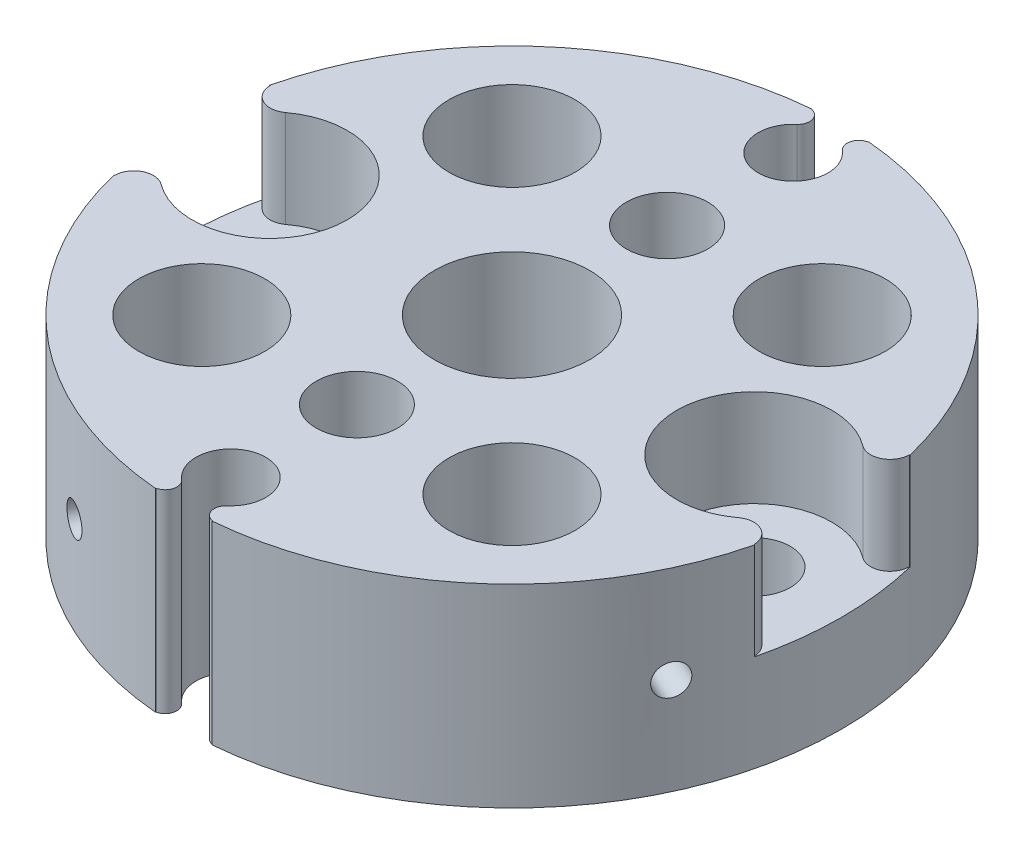
from build123d import *

# Parameters (mm, degrees)
SKETCH1_R                  = 17
BOSS_EXTRUDE1_DEPTH        = 10
F_3_7_3_7_DIAMETER_HOLE1_D = 3.7
M5_TAPPED_HOLE1_D          = 4.2
F_12_0_12_DIAMETER_HOLE1_D = 8
CUT_EXTRUDE3_DEPTH         = 5
CIRPATTERN1_COUNT          = 4
SKETCH21_R                 = 3.25
CUT_EXTRUDE4_DEPTH         = 27.038433302
CUT_EXTRUDE5_DEPTH         = 27.038433302


with BuildPart() as part:
    # Sketch1 → Boss-Extrude1 (new body)
    with BuildSketch(Plane(origin=(0, 0, 0), x_dir=(1, 0, 0), z_dir=(0, 1, 0))):
        with Locations(Location((0, 0, 0), (0, 0, 270))):
            Circle(SKETCH1_R)
    extrude(amount=BOSS_EXTRUDE1_DEPTH)

    # Ø3.7 (3.7) Diameter Hole1 (through all)
    with Locations(Plane(origin=(0, 10, 0), x_dir=(1, 0, 0), z_dir=(0, 1, 0))):
        with Locations((-12.5, 0), (12.5, 0)):
            Hole(F_3_7_3_7_DIAMETER_HOLE1_D / 2)

    # M5 Tapped Hole1 (through all)
    with Locations(Plane(origin=(0, 10, 0), x_dir=(1, 0, 0), z_dir=(0, 1, 0))):
        with Locations((0, 8), (0, -8)):
            Hole(M5_TAPPED_HOLE1_D / 2)

    # Ø12.0 (12) Diameter Hole1 (through all)
    with Locations(Plane(origin=(0, 10, 0), x_dir=(1, 0, 0), z_dir=(0, 1, 0))):
        with Locations((0, 0)):
            Hole(F_12_0_12_DIAMETER_HOLE1_D / 2)

    # Sketch16 → Cut-Extrude3 (cut)
    with BuildSketch(Plane(origin=(0, 10, 0), x_dir=(1, 0, 0), z_dir=(0, 1, 0))):
        with BuildLine():
            Line((-16.487793391, 4.015586089), (-18.960782116, 4.015586089))
            Line((-18.960782116, 4.015586089), (-18.960782116, -4.01131039))
            Line((-18.960782116, -4.01131039), (-16.488958096, -4.01131039))
            ThreePointArc((-16.488958096, -4.01131039), (-15.936832629, -3.116268297), (-14.889208553, -3.208065225))
            ThreePointArc((-14.889208553, -3.208065225), (-8.500000472, -0.001943416), (-14.886090124, 3.210385323))
            ThreePointArc((-14.886090124, 3.210385323), (-15.935159239, 3.119232137), (-16.487793391, 4.015586089))
        make_face()
        with BuildLine():
            Line((16.487793391, -4.015586089), (18.960782116, -4.015586089))
            Line((18.960782116, -4.015586089), (18.960782116, 4.01131039))
            Line((18.960782116, 4.01131039), (16.488958096, 4.01131039))
            ThreePointArc((16.488958096, 4.01131039), (15.936832629, 3.116268297), (14.889208553, 3.208065225))
            ThreePointArc((14.889208553, 3.208065225), (8.500000472, 0.001943416), (14.886090124, -3.210385323))
            ThreePointArc((14.886090124, -3.210385323), (15.935159239, -3.119232137), (16.487793391, -4.015586089))
        make_face()
    extrude(amount=-CUT_EXTRUDE3_DEPTH, mode=Mode.SUBTRACT)

    # Sketch18 → M2 Tapped Hole1 (revolve, cut)
    with BuildSketch(Plane(origin=(15.40723238, 5, 7.18451045), x_dir=(0.42261826174070016, 0, -0.9063077870366497), z_dir=(0, 1, 0))):
        Polygon((0, 0), (0, 4.480688495), (0.8, 4), (0.8, 0), align=None)
    m2_tapped_hole1 = revolve(axis=Axis((21.162286827, 5, 9.868136412), (-0.9063077870366497, 0, -0.42261826174070016)), mode=Mode.SUBTRACT)

    # CirPattern1: M2 Tapped Hole1 ×4 about axis
    cirpattern1_axis = Axis((0, 0, 0), (0, 1, 0))
    for i in range(1, CIRPATTERN1_COUNT):
        add(m2_tapped_hole1.rotate(cirpattern1_axis, i * 360 / CIRPATTERN1_COUNT), mode=Mode.SUBTRACT)

    # Sketch21 → Cut-Extrude4 (cut, through all)
    with BuildSketch(Plane(origin=(0, 10, 0), x_dir=(1, 0, 0), z_dir=(0, 1, 0))):
        with Locations(Location((-8, 8, 0), (0, 0, 270))):
            Circle(SKETCH21_R)
        with Locations(Location((8, 8, 0), (0, 0, 270))):
            Circle(SKETCH21_R)
        with Locations(Location((8, -8, 0), (0, 0, 270))):
            Circle(SKETCH21_R)
        with Locations(Location((-8, -8, 0), (0, 0, 270))):
            Circle(SKETCH21_R)
    extrude(amount=-CUT_EXTRUDE4_DEPTH, mode=Mode.SUBTRACT)

    # Sketch14 → Cut-Extrude5 (cut, through all)
    with BuildSketch(Plane(origin=(0, 10, 0), x_dir=(1, 0, 0), z_dir=(0, 1, 0))):
        with BuildLine():
            Line((-1.459621356, 16.913091325), (-1.166781334, 18.506531105))
            Line((-1.166781334, 18.506531105), (1.608035184, 18.356142043))
            Line((1.608035184, 18.356142043), (1.452856339, 16.913870267))
            ThreePointArc((1.452856339, 16.913870267), (0.984569232, 16.476462251), (1.174122642, 15.864344539))
            ThreePointArc((1.174122642, 15.864344539), (0.000614681, 12.700000105), (-1.175054186, 15.86354232))
            ThreePointArc((-1.175054186, 15.86354232), (-0.986764651, 16.477946041), (-1.459621356, 16.913091325))
        make_face()
        with BuildLine():
            Line((1.459621356, -16.913091325), (1.166781334, -18.506531105))
            Line((1.166781334, -18.506531105), (-1.608035184, -18.356142043))
            Line((-1.608035184, -18.356142043), (-1.452856339, -16.913870267))
            ThreePointArc((-1.452856339, -16.913870267), (-0.984569232, -16.476462251), (-1.174122642, -15.864344539))
            ThreePointArc((-1.174122642, -15.864344539), (-0.000614681, -12.700000105), (1.175054186, -15.86354232))
            ThreePointArc((1.175054186, -15.86354232), (0.986764651, -16.477946041), (1.459621356, -16.913091325))
        make_face()
    extrude(amount=-CUT_EXTRUDE5_DEPTH, mode=Mode.SUBTRACT)


solid = part.part
